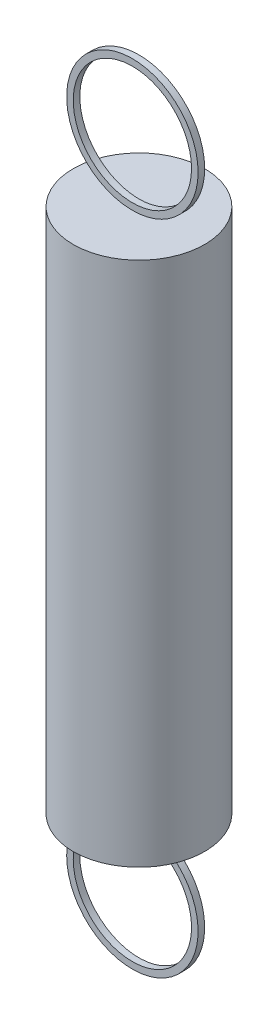
from build123d import *

# Parameters (mm, degrees)
SKETCH1_R             = 5
BOSS_EXTRUDE1_DEPTH   = 40
SKETCH3_R             = 5
SKETCH3_R_2           = 4.5
BOSS_EXTRUDE2_DEPTH   = 0.5
BOSS_EXTRUDE2_2_DEPTH = 0.5


with BuildPart() as part:
    # Sketch1 → Boss-Extrude1 (new body)
    with BuildSketch(Plane(origin=(0, 0, 0), x_dir=(1, 0, 0), z_dir=(0, 1, 0))):
        with Locations(Location((0, 0, 0), (0, 0, 270))):
            Circle(SKETCH1_R)
    extrude(amount=BOSS_EXTRUDE1_DEPTH)


with BuildPart() as body_2:
    # Sketch3 → Boss-Extrude2 (new body)
    with BuildSketch(Plane.XY):
        with Locations((0, 45)):
            Circle(SKETCH3_R)
        with Locations((0, 45)):
            Circle(SKETCH3_R_2, mode=Mode.SUBTRACT)
    extrude(amount=BOSS_EXTRUDE2_DEPTH)


with BuildPart() as body_3:
    # Sketch3 → Boss-Extrude2 2 (new body)
    with BuildSketch(Plane.XY):
        with Locations(Location((0, -5, 0), (0, 0, 180))):
            Circle(SKETCH3_R)
        with Locations(Location((0, -5, 0), (0, 0, 180))):
            Circle(SKETCH3_R_2, mode=Mode.SUBTRACT)
    extrude(amount=BOSS_EXTRUDE2_2_DEPTH)


solid = Compound([part.part, body_2.part, body_3.part])
